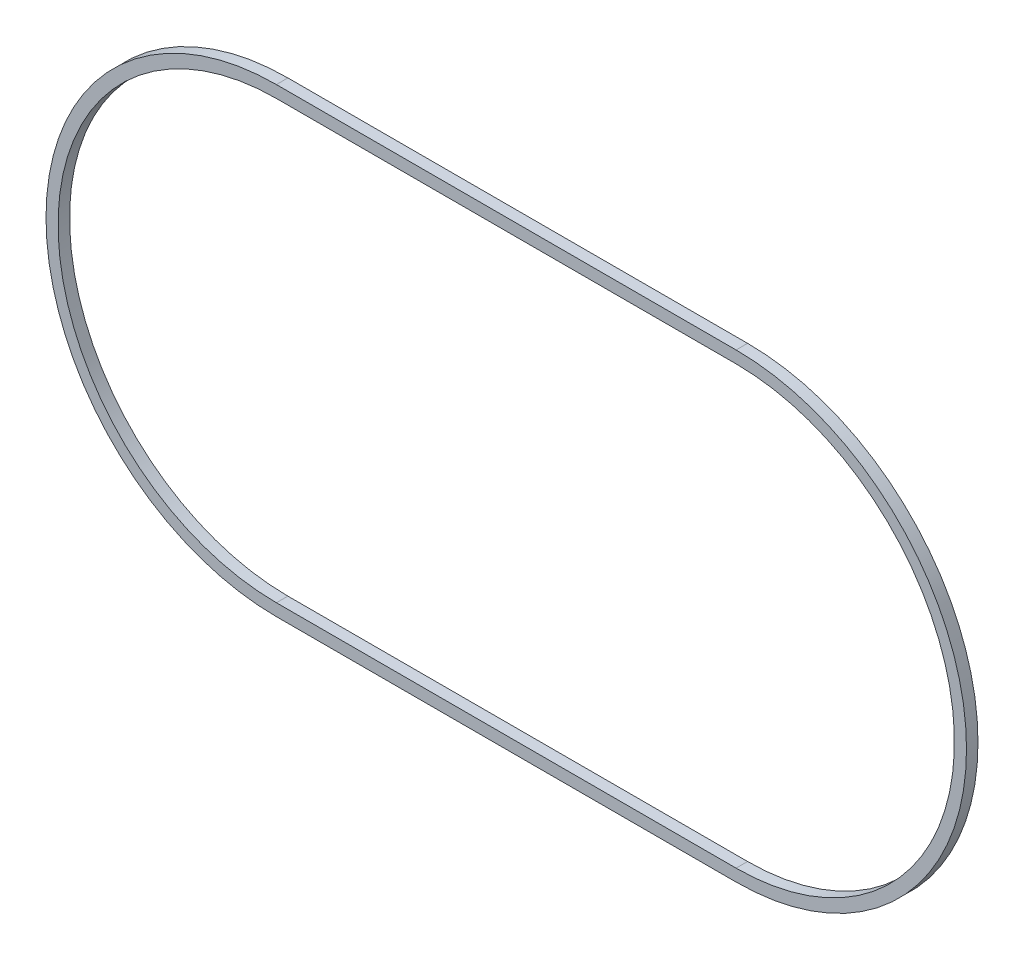
from build123d import *

# Parameters (mm, degrees)
EXTRUDE_1_DEPTH = 2


with BuildPart() as part:
    # Эскиз1 → Бобышка-Вытянуть1 (new body)
    with BuildSketch(Plane.XY):
        with BuildLine():
            Line((-40, -40.1), (40, -40.1))
            ThreePointArc((40, -40.1), (80.1, 0), (40, 40.1))
            Line((40, 40.1), (-40, 40.1))
            ThreePointArc((-40, 40.1), (-80.1, 0), (-40, -40.1))
        make_face()
        with BuildLine():
            Line((-40, 38), (40, 38))
            ThreePointArc((40, 38), (78, 0), (40, -38))
            Line((40, -38), (-40, -38))
            ThreePointArc((-40, -38), (-78, 0), (-40, 38))
        make_face(mode=Mode.SUBTRACT)
    extrude(amount=EXTRUDE_1_DEPTH)


solid = part.part
